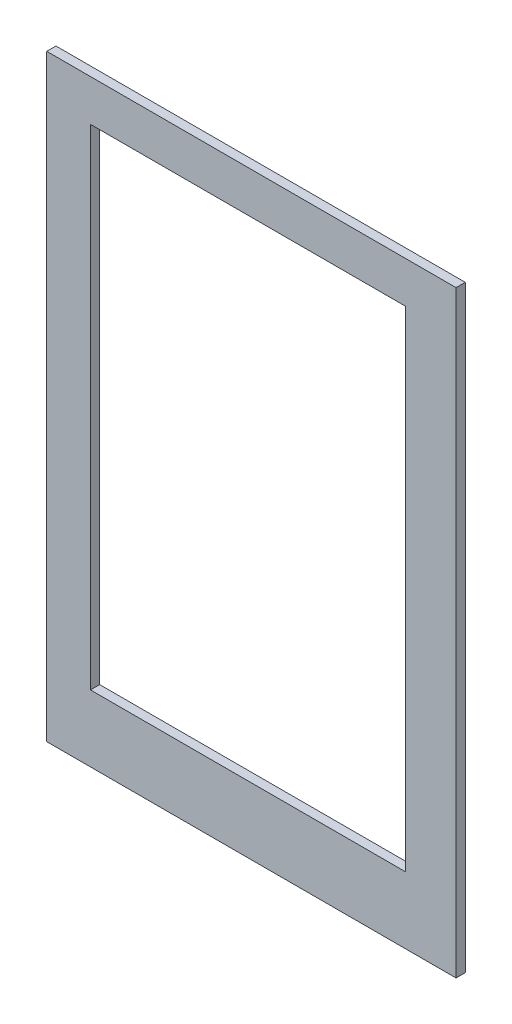
from build123d import *

# Parameters (mm, degrees)
SKETCH1_W           = 178
SKETCH1_H           = 260
SKETCH1_W_2         = 137
SKETCH1_H_2         = 213
BOSS_EXTRUDE1_DEPTH = 4


with BuildPart() as part:
    # Sketch1 → Boss-Extrude1 (new body)
    with BuildSketch(Plane.XY.offset(-68.673711015)):
        with Locations((-64.434862251, -10.875314363)):
            Rectangle(SKETCH1_W, SKETCH1_H)
        with Locations((-65.934862251, -5.375314363)):
            Rectangle(SKETCH1_W_2, SKETCH1_H_2, mode=Mode.SUBTRACT)
    extrude(amount=BOSS_EXTRUDE1_DEPTH)


solid = part.part
